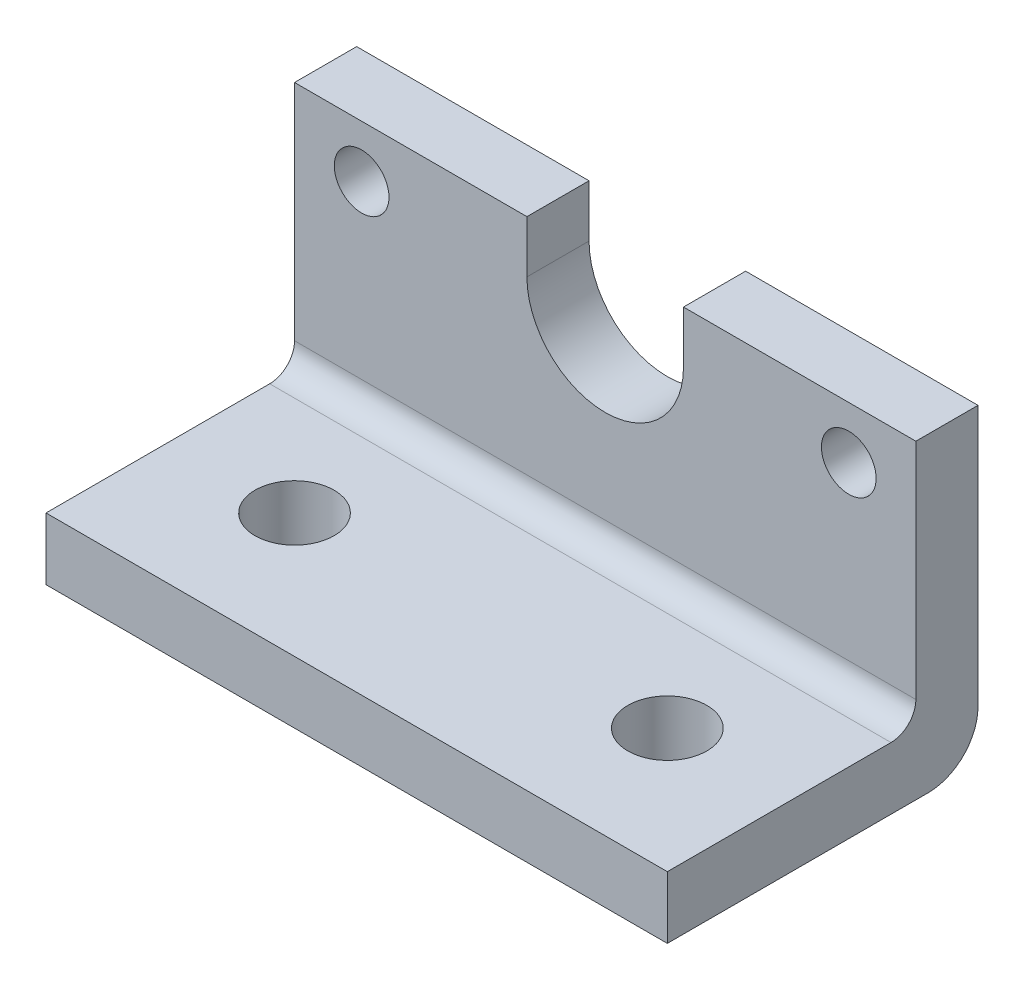
from build123d import *

# Parameters (mm, degrees)
SKETCH1_R           = 1.397
BOSS_EXTRUDE1_DEPTH = 3.175
SKETCH2_W           = 31.75
SKETCH2_H           = 12.7
SKETCH2_R           = 2.0193
BOSS_EXTRUDE2_DEPTH = 3.175
FILLET1_R           = 1.27
FILLET2_R           = 2.54


with BuildPart() as part:
    # Sketch1 → Boss-Extrude1 (new body)
    with BuildSketch(Plane.XY):
        with BuildLine():
            Line((-4.0005, 13.208), (-4.0005, 15.875))
            Line((-4.0005, 15.875), (-15.875, 15.875))
            Line((-15.875, 15.875), (-15.875, 0))
            Line((-15.875, 0), (15.875, 0))
            Line((15.875, 0), (15.875, 15.875))
            Line((15.875, 15.875), (4.0005, 15.875))
            Line((4.0005, 15.875), (4.0005, 13.208))
            ThreePointArc((4.0005, 13.208), (0, 9.2075), (-4.0005, 13.208))
        make_face()
        with Locations((12.446, 13.208)):
            Circle(SKETCH1_R, mode=Mode.SUBTRACT)
        with Locations((-12.446, 13.208)):
            Circle(SKETCH1_R, mode=Mode.SUBTRACT)
    extrude(amount=-BOSS_EXTRUDE1_DEPTH)

    # Sketch2 → Boss-Extrude2 (add)
    with BuildSketch(Plane(origin=(0, 0, 0), x_dir=(1, 0, 0), z_dir=(0, 1, 0))):
        with Locations((0, -6.35)):
            Rectangle(SKETCH2_W, SKETCH2_H)
        with Locations(Location((-9.525, -6.35, 0), (0, 0, 270))):
            Circle(SKETCH2_R, mode=Mode.SUBTRACT)
        with Locations(Location((9.525, -6.35, 0), (0, 0, 270))):
            Circle(SKETCH2_R, mode=Mode.SUBTRACT)
    extrude(amount=BOSS_EXTRUDE2_DEPTH)

    # Fillet1
    fillet1_edges = [part.edges().sort_by_distance(p)[0] for p in [
        (0, 3.175, 0),
    ]]
    fillet(fillet1_edges, radius=FILLET1_R)

    # Fillet2
    fillet2_edges = [part.edges().sort_by_distance(p)[0] for p in [
        (0, 0, -3.175),
    ]]
    fillet(fillet2_edges, radius=FILLET2_R)


solid = part.part
